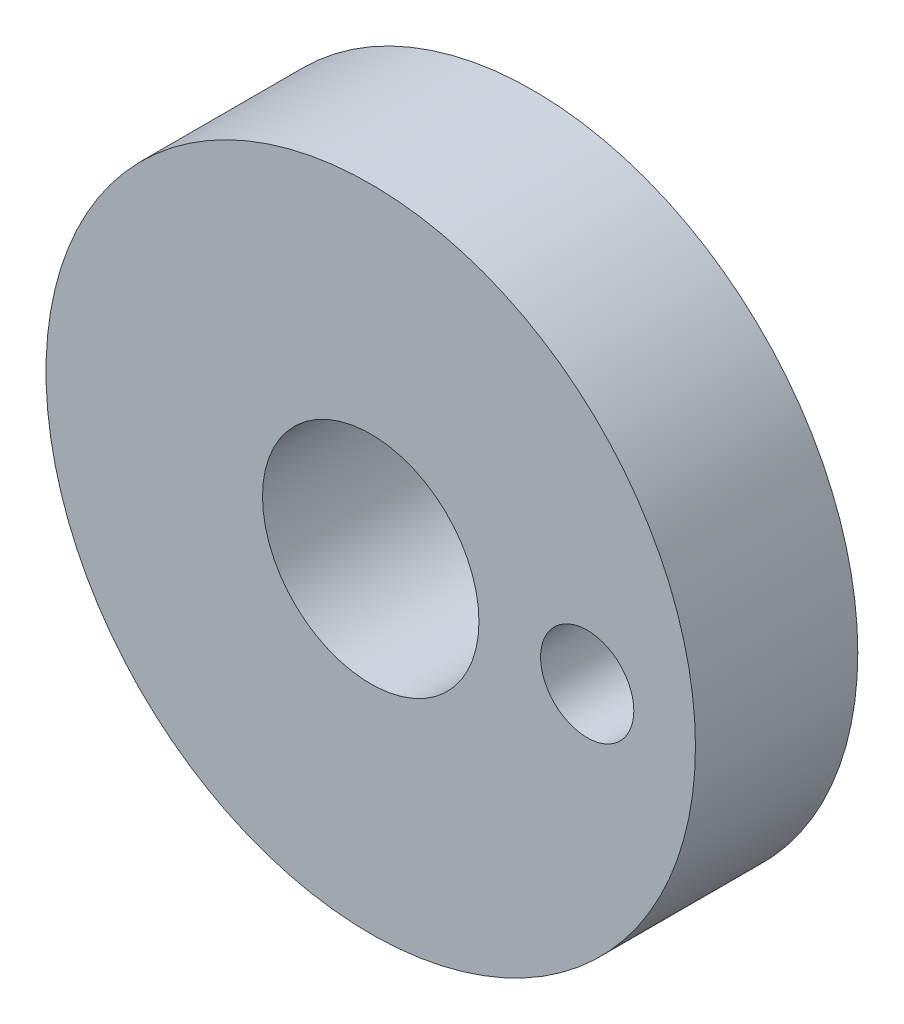
from build123d import *

# Parameters (mm, degrees)
SKETCH1_R           = 30
SKETCH1_R_2         = 4.305586378
SKETCH1_R_3         = 10
BOSS_EXTRUDE1_DEPTH = 15


with BuildPart() as part:
    # Sketch1 → Boss-Extrude1 (new body)
    with BuildSketch(Plane.XY):
        Circle(SKETCH1_R)
        with Locations((20, 0)):
            Circle(SKETCH1_R_2, mode=Mode.SUBTRACT)
        Circle(SKETCH1_R_3, mode=Mode.SUBTRACT)
    extrude(amount=BOSS_EXTRUDE1_DEPTH)


solid = part.part
